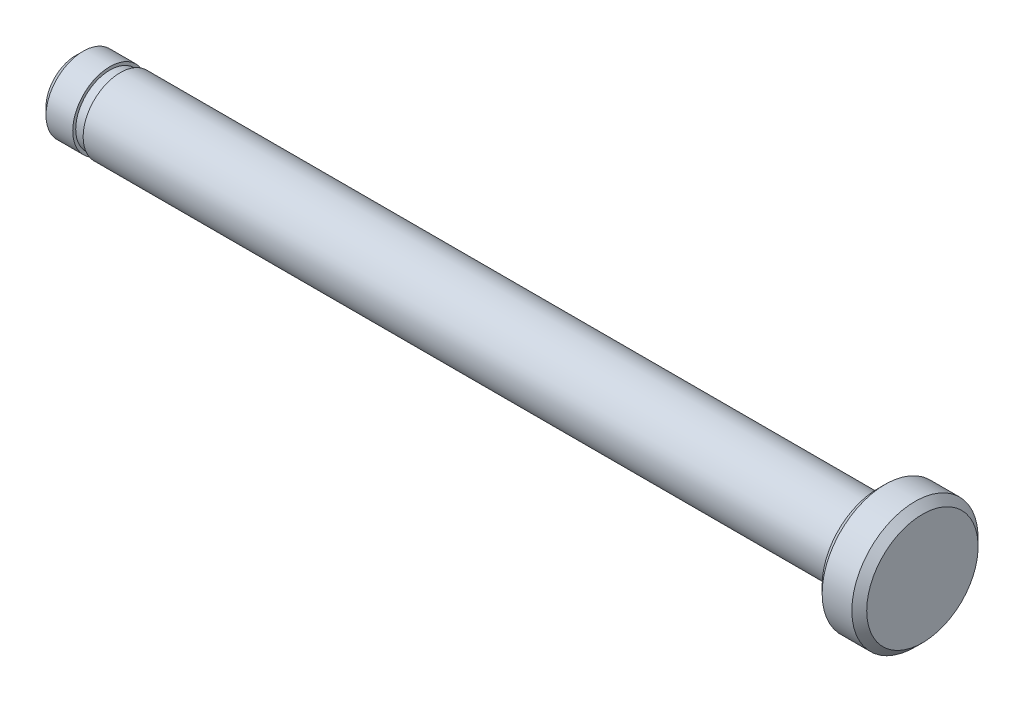
from build123d import *


with BuildPart() as part:
    # Sketch1 → Revolve1 (revolve)
    with BuildSketch(Plane(origin=(0, 0, 0), x_dir=(1, 0, 0), z_dir=(0, 1, 0)), mode=Mode.PRIVATE) as revolve1_sk:
        Polygon((-28.5, 0), (28.5, 0), (28.5, 3.75), (28, 4.25), (26, 4.25), (25.5, 3.75), (25.5, 2.5), (-25.5, 2.5), (-25.5, 2.3), (-26.2, 2.3), (-26.2, 2.5), (-28, 2.5), (-28.5, 2), align=None)
    revolve(revolve1_sk.sketch.rotate(Axis((-28.5, 0, 0), (1, 0, 0)), 180), axis=Axis((-28.5, 0, 0), (1, 0, 0)))


solid = part.part
